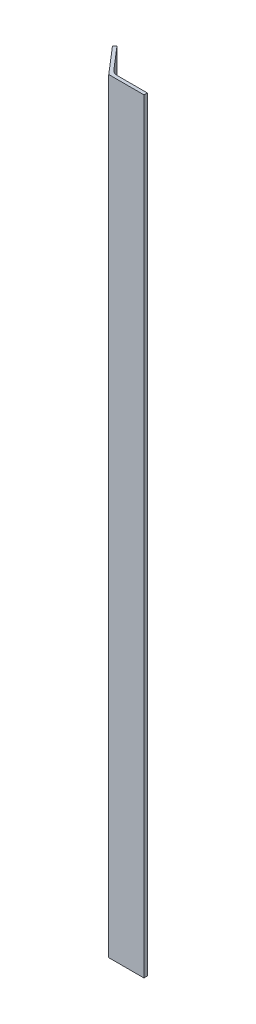
from build123d import *

# Parameters (mm, degrees)
EXTRUDE_START   = 40
EXTRUDE_1_DEPTH = 460


with BuildPart() as part:
    # Эскиз1 → Вытянуть1 (new body)
    with BuildSketch(Plane(origin=(0, 0, 0), x_dir=(1, 0, 0), z_dir=(0, 1, 0)).offset(EXTRUDE_START)):
        with BuildLine():
            Line((-17.766709847, 14.4460477), (-16.308397656, 15.700046652))
            Line((-16.308397656, 15.700046652), (-4.722880617, 2.226908794))
            ThreePointArc((-4.722880617, 2.226908794), (-3.017444081, 0.942662024), (-0.931762463, 0.48688167))
            Line((-0.931762463, 0.48688167), (17.122829042, 0.48688167))
            Line((17.122829042, 0.48688167), (17.122829042, -1.51311833))
            Line((17.122829042, -1.51311833), (-4.043463493, -1.51311833))
            Line((-4.043463493, -1.51311833), (-17.766709847, 14.4460477))
        make_face()
    extrude(amount=EXTRUDE_1_DEPTH)


solid = part.part
